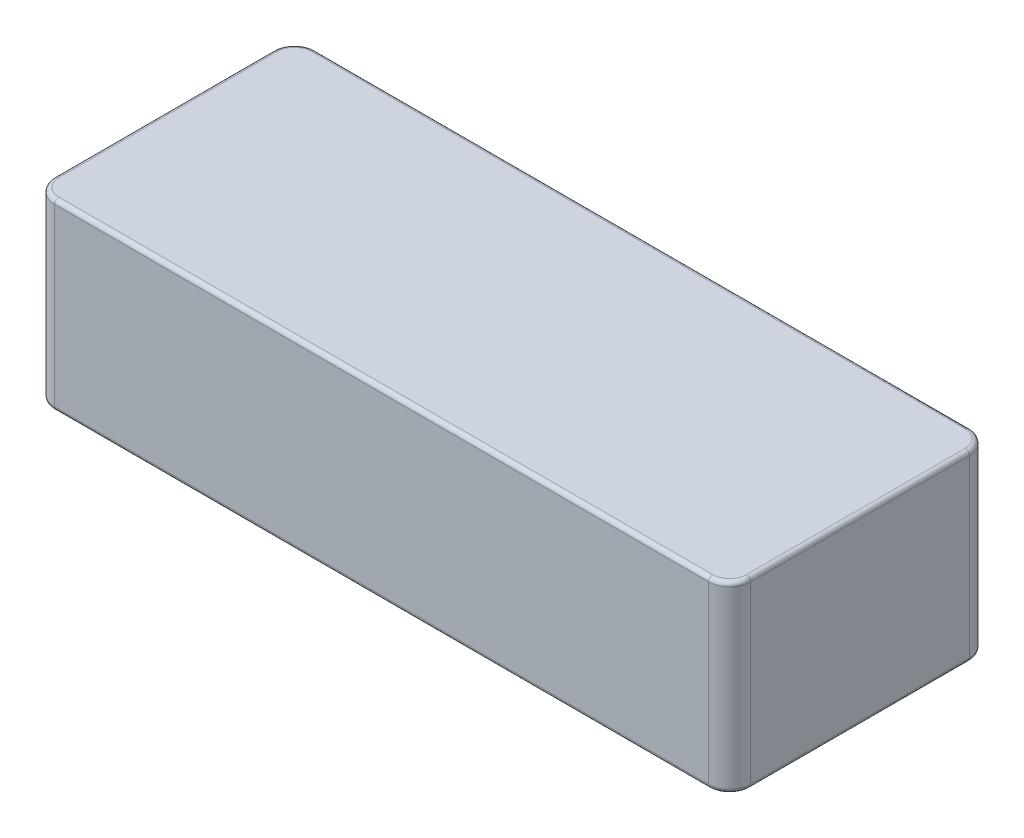
from build123d import *

# Parameters (mm, degrees)
SKETCH1_W           = 166
SKETCH1_H           = 62.2
BOSS_EXTRUDE1_DEPTH = 43.8
FILLET1_R           = 5
FILLET2_R           = 1


with BuildPart() as part:
    # Sketch1 → Boss-Extrude1 (new body)
    with BuildSketch(Plane(origin=(0, 0, 0), x_dir=(1, 0, 0), z_dir=(0, 1, 0))):
        Rectangle(SKETCH1_W, SKETCH1_H)
    extrude(amount=BOSS_EXTRUDE1_DEPTH)

    # Fillet1
    fillet1_edges = [part.edges().sort_by_distance(p)[0] for p in [
        (83, 21.9, 31.1),
        (-83, 21.9, 31.1),
        (-83, 21.9, -31.1),
        (83, 21.9, -31.1),
    ]]
    fillet(fillet1_edges, radius=FILLET1_R)

    # Fillet2
    fillet2_edges = [part.edges().sort_by_distance(p)[0] for p in [
        (0, 0, -31.1),
        (0, 43.8, -31.1),
        (83, 0, 0),
        (0, 0, 31.1),
        (-83, 0, 0),
        (-81.535533906, 0, 29.635533906),
        (-81.535533906, 0, -29.635533906),
        (81.535533906, 0, 29.635533906),
        (81.535533906, 0, -29.635533906),
        (83, 43.8, 0),
        (-83, 43.8, 0),
        (0, 43.8, 31.1),
        (-81.535533906, 43.8, 29.635533906),
        (-81.535533906, 43.8, -29.635533906),
        (81.535533906, 43.8, 29.635533906),
        (81.535533906, 43.8, -29.635533906),
    ]]
    fillet(fillet2_edges, radius=FILLET2_R)


solid = part.part
